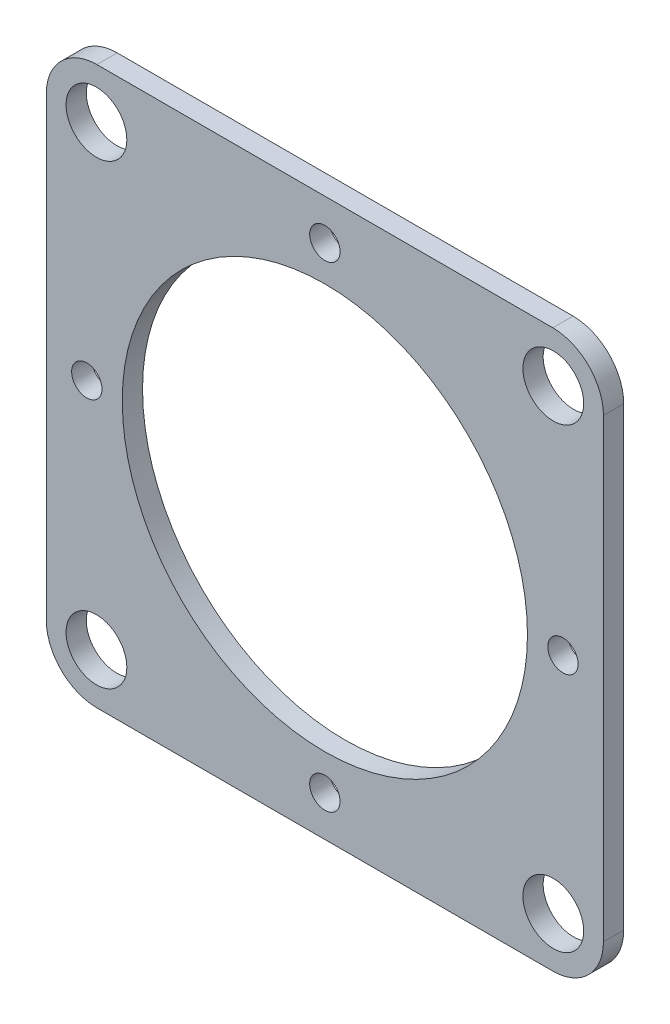
from build123d import *

# Parameters (mm, degrees)
CROQUIS1_W              = 55
CROQUIS1_H              = 55
CROQUIS1_R              = 20
CROQUIS1_R_2            = 3
CROQUIS1_R_3            = 1.5
SALIENTE_EXTRUIR1_DEPTH = 2
REDONDEO1_R             = 5


with BuildPart() as part:
    # Croquis1 → Saliente-Extruir1 (new body)
    with BuildSketch(Plane.XY):
        Rectangle(CROQUIS1_W, CROQUIS1_H)
        Circle(CROQUIS1_R, mode=Mode.SUBTRACT)
        with Locations((-22.550252532, 22.550252532)):
            Circle(CROQUIS1_R_2, mode=Mode.SUBTRACT)
        with Locations((22.550252532, 22.550252532)):
            Circle(CROQUIS1_R_2, mode=Mode.SUBTRACT)
        with Locations((22.550252532, -22.550252532)):
            Circle(CROQUIS1_R_2, mode=Mode.SUBTRACT)
        with Locations((-22.550252532, -22.550252532)):
            Circle(CROQUIS1_R_2, mode=Mode.SUBTRACT)
        with Locations((0, 23.5)):
            Circle(CROQUIS1_R_3, mode=Mode.SUBTRACT)
        with Locations((23.5, 0)):
            Circle(CROQUIS1_R_3, mode=Mode.SUBTRACT)
        with Locations((0, -23.5)):
            Circle(CROQUIS1_R_3, mode=Mode.SUBTRACT)
        with Locations((-23.5, 0)):
            Circle(CROQUIS1_R_3, mode=Mode.SUBTRACT)
    extrude(amount=SALIENTE_EXTRUIR1_DEPTH)

    # Redondeo1
    redondeo1_edges = [part.edges().sort_by_distance(p)[0] for p in [
        (-27.5, 27.5, 1),
        (27.5, 27.5, 1),
        (27.5, -27.5, 1),
        (-27.5, -27.5, 1),
    ]]
    fillet(redondeo1_edges, radius=REDONDEO1_R)


solid = part.part
